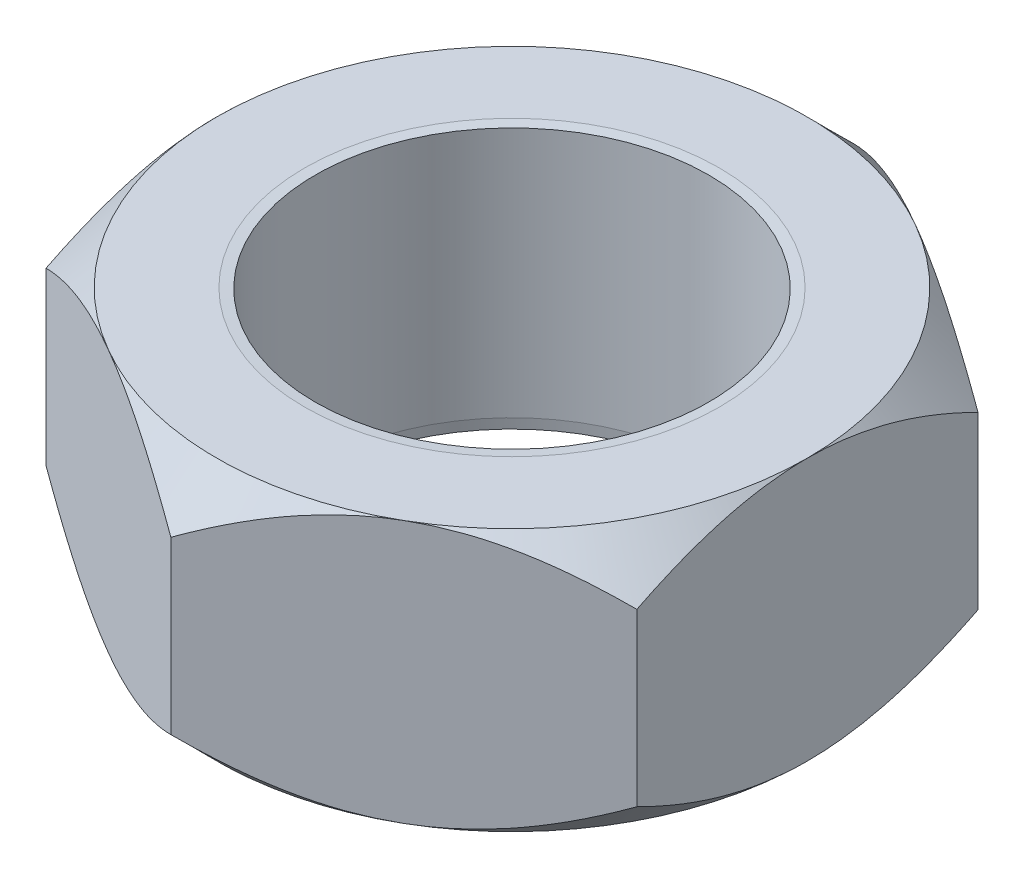
from build123d import *

# Parameters (mm, degrees)
BOSS_EXTRUDE1_DEPTH = 6.35
SKETCH2_R           = 4.7625
CUT_EXTRUDE1_DEPTH  = 13.633751225
CHAMFER2_SIZE       = 0.254
CHAMFER2_SIZE2      = 0.022222121
CHAMFER3_SIZE       = 0.254
CHAMFER3_SIZE2      = 0.022222121
SKETCH3_OUTSIDE_W   = 33.55
SKETCH3_OUTSIDE_H   = 35.762
SKETCH3_OUTSIDE_R   = 7.150103868
CUT_EXTRUDE2_DEPTH  = 6.35
CUT_EXTRUDE2_DRAFT  = -45
SKETCH4_OUTSIDE_W   = 33.55
SKETCH4_OUTSIDE_H   = 35.762
SKETCH4_OUTSIDE_R   = 7.1501
CUT_EXTRUDE3_DEPTH  = 6.35
CUT_EXTRUDE3_DRAFT  = -45


with BuildPart() as part:
    # Sketch1 → Boss-Extrude1 (new body)
    with BuildSketch(Plane(origin=(0, 0, 0), x_dir=(1, 0, 0), z_dir=(0, 1, 0))):
        Polygon((0, 8.256224319), (-7.1501, 4.12811216), (-7.1501, -4.12811216), (0, -8.256224319), (7.1501, -4.12811216), (7.1501, 4.12811216), align=None)
    extrude(amount=BOSS_EXTRUDE1_DEPTH)

    # Sketch2 → Cut-Extrude1 (cut, through all)
    with BuildSketch(Plane(origin=(0, 6.35, 0), x_dir=(1, 0, 0), z_dir=(0, 1, 0))):
        with Locations(Location((0, 0, 0), (0, 0, 270))):
            Circle(SKETCH2_R)
    extrude(amount=-CUT_EXTRUDE1_DEPTH, mode=Mode.SUBTRACT)

    # Chamfer2
    chamfer2_edges = [part.edges().sort_by_distance(p)[0] for p in [
        (0, 6.35, -4.7625),
    ]]
    chamfer2_side = [part.faces().sort_by_distance(p)[0] for p in [
        (-3.465830418, 6.35, -6.002994375),
    ]]
    chamfer(chamfer2_edges, length=CHAMFER2_SIZE, length2=CHAMFER2_SIZE2, reference=chamfer2_side[0])

    # Chamfer3
    chamfer3_edges = [part.edges().sort_by_distance(p)[0] for p in [
        (0, 0, -4.7625),
    ]]
    chamfer3_side = [part.faces().sort_by_distance(p)[0] for p in [
        (0, 3.16388894, -4.7625),
    ]]
    chamfer(chamfer3_edges, length=CHAMFER3_SIZE, length2=CHAMFER3_SIZE2, reference=chamfer3_side[0])


with BuildPart() as cut_extrude2_tool:
    # Sketch3 outside → Cut-Extrude2 (with draft: the straight prism first)
    with BuildSketch(Plane(origin=(0, 6.35, 0), x_dir=(1, 0, 0), z_dir=(0, 1, 0))):
        Rectangle(SKETCH3_OUTSIDE_W, SKETCH3_OUTSIDE_H)
        Circle(SKETCH3_OUTSIDE_R, mode=Mode.SUBTRACT)
    extrude(amount=-CUT_EXTRUDE2_DEPTH)
    # Cut-Extrude2: the draft: its side faces are tilted about the plane it starts from
    cut_extrude2_sides = [cut_extrude2_tool.faces().sort_by_distance(p)[0] for p in [
        (0, 3.175, 17.881),
        (16.775, 3.175, 0),
        (0, 3.175, -17.881),
        (-16.775, 3.175, 0),
        (-7.150103868, 3.175, 0),
    ]]
    draft(cut_extrude2_sides, Plane(origin=(0, 6.35, 0), x_dir=(1, 0, 0), z_dir=(0, 1, 0)), CUT_EXTRUDE2_DRAFT)


with BuildPart() as part_1:
    add(part.part)

    # Cut-Extrude2: cut by cut_extrude2_tool
    add(cut_extrude2_tool.part, mode=Mode.SUBTRACT)


with BuildPart() as cut_extrude3_tool:
    # Sketch4 outside → Cut-Extrude3 (with draft: the straight prism first)
    with BuildSketch(Plane.XZ):
        Rectangle(SKETCH4_OUTSIDE_W, SKETCH4_OUTSIDE_H)
        Circle(SKETCH4_OUTSIDE_R, mode=Mode.SUBTRACT)
    extrude(amount=-CUT_EXTRUDE3_DEPTH)
    # Cut-Extrude3: the draft: its side faces are tilted about the plane it starts from
    cut_extrude3_sides = [cut_extrude3_tool.faces().sort_by_distance(p)[0] for p in [
        (0, 3.175, -17.881),
        (16.775, 3.175, 0),
        (0, 3.175, 17.881),
        (-16.775, 3.175, 0),
        (-7.1501, 3.175, 0),
    ]]
    draft(cut_extrude3_sides, Plane.XZ, CUT_EXTRUDE3_DRAFT)


with BuildPart() as part_2:
    add(part_1.part)

    # Cut-Extrude3: cut by cut_extrude3_tool
    add(cut_extrude3_tool.part, mode=Mode.SUBTRACT)


solid = part_2.part
